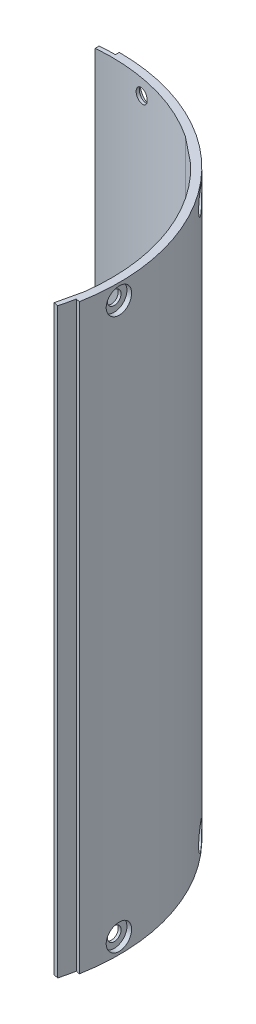
from build123d import *

# Parameters (mm, degrees)
EXTRUDE_2_DEPTH          = 149
SKETCH_15_R              = 3.25
CUT_EXTRUDE_5_DEPTH      = 1.3
SKETCH_16_R              = 1.75
CUT_EXTRUDE_6_DEPTH      = 167.38914097
PATTERN_CIRCULAR_3_COUNT = 5
PATTERN_CIRCULAR_3_ANGLE = 80
SKETCH_17_R              = 3.25
CUT_EXTRUDE_7_DEPTH      = 1.3
SKETCH_18_R              = 1.75
CUT_EXTRUDE_8_DEPTH      = 167.389141002
PATTERN_CIRCULAR_5_COUNT = 5
PATTERN_CIRCULAR_5_ANGLE = 80


with BuildPart() as part:
    # Эскиз2 → Бобышка-Вытянуть2 (new body)
    with BuildSketch(Plane(origin=(0, 0, 0), x_dir=(1, 0, 0), z_dir=(0, 1, 0))):
        with BuildLine():
            Line((47.135590279, -12.793597189), (48.266574667, -13.051351269))
            ThreePointArc((48.266574667, -13.051351269), (48.75, -11.110243022), (49.155394108, -9.151351269))
            Line((49.155394108, -9.151351269), (50.131159715, -9.373730613))
            ThreePointArc((50.131159715, -9.373730613), (39.236846594, 32.580206711), (0, 51))
            Line((0, 51), (0, 50))
            ThreePointArc((0, 50), (-2, 49.959983987), (-3.996798719, 49.84))
            Line((-3.996798719, 49.84), (-3.996798719, 48.836723887))
            ThreePointArc((-3.996798719, 48.836723887), (12.196177114, 47.457910445), (27.047555214, 40.858655839))
            Line((27.047555214, 40.858655839), (33.952444786, 35.330319742))
            ThreePointArc((33.952444786, 35.330319742), (46.263287314, 16.146462365), (48.562738521, -6.531495034))
            Line((48.562738521, -6.531495034), (47.135590279, -12.793597189))
        make_face()
    extrude(amount=EXTRUDE_2_DEPTH)

    # Эскиз15 → Вырез-Вытянуть5 (cut)
    with BuildSketch(Plane(origin=(51, 0, 0), x_dir=(0, 0, -1), z_dir=(1, 0, 0))):
        with Locations((0, 4)):
            Circle(SKETCH_15_R)
    cut_extrude_5 = extrude(amount=-CUT_EXTRUDE_5_DEPTH, mode=Mode.SUBTRACT)

    # Эскиз16 → Вырез-Вытянуть6 (cut, through all)
    with BuildSketch(Plane(origin=(49.7, 0, 0), x_dir=(0, 0, -1), z_dir=(1, 0, 0))):
        with Locations((0, 4)):
            Circle(SKETCH_16_R)
    cut_extrude_6 = extrude(amount=-CUT_EXTRUDE_6_DEPTH, mode=Mode.SUBTRACT)

    # Круговой массив3: Вырез-Вытянуть5, Вырез-Вытянуть6 ×5 about axis, 2 skipped
    pattern_circular_3_axis = Axis((0, 0, 0), (0, 1, 0))
    add([cut_extrude_5.rotate(pattern_circular_3_axis, i * PATTERN_CIRCULAR_3_ANGLE / (PATTERN_CIRCULAR_3_COUNT - 1)) for i in range(1, PATTERN_CIRCULAR_3_COUNT) if i not in (1, 3)], mode=Mode.SUBTRACT)
    add([cut_extrude_6.rotate(pattern_circular_3_axis, i * PATTERN_CIRCULAR_3_ANGLE / (PATTERN_CIRCULAR_3_COUNT - 1)) for i in range(1, PATTERN_CIRCULAR_3_COUNT) if i not in (1, 3)], mode=Mode.SUBTRACT)

    # Эскиз17 → Вырез-Вытянуть7 (cut)
    with BuildSketch(Plane(origin=(51, 0, 0), x_dir=(0, 0, -1), z_dir=(1, 0, 0))):
        with Locations((0, 145)):
            Circle(SKETCH_17_R)
    cut_extrude_7 = extrude(amount=-CUT_EXTRUDE_7_DEPTH, mode=Mode.SUBTRACT)

    # Эскиз18 → Вырез-Вытянуть8 (cut, through all)
    with BuildSketch(Plane(origin=(49.7, 0, 0), x_dir=(0, 0, -1), z_dir=(1, 0, 0))):
        with Locations((0, 145)):
            Circle(SKETCH_18_R)
    cut_extrude_8 = extrude(amount=-CUT_EXTRUDE_8_DEPTH, mode=Mode.SUBTRACT)

    # Круговой массив5: Вырез-Вытянуть7, Вырез-Вытянуть8 ×5 about axis, 2 skipped
    pattern_circular_5_axis = Axis((0, 149, 0), (0, 1, 0))
    add([cut_extrude_7.rotate(pattern_circular_5_axis, i * PATTERN_CIRCULAR_5_ANGLE / (PATTERN_CIRCULAR_5_COUNT - 1)) for i in range(1, PATTERN_CIRCULAR_5_COUNT) if i not in (1, 3)], mode=Mode.SUBTRACT)
    add([cut_extrude_8.rotate(pattern_circular_5_axis, i * PATTERN_CIRCULAR_5_ANGLE / (PATTERN_CIRCULAR_5_COUNT - 1)) for i in range(1, PATTERN_CIRCULAR_5_COUNT) if i not in (1, 3)], mode=Mode.SUBTRACT)


solid = part.part
